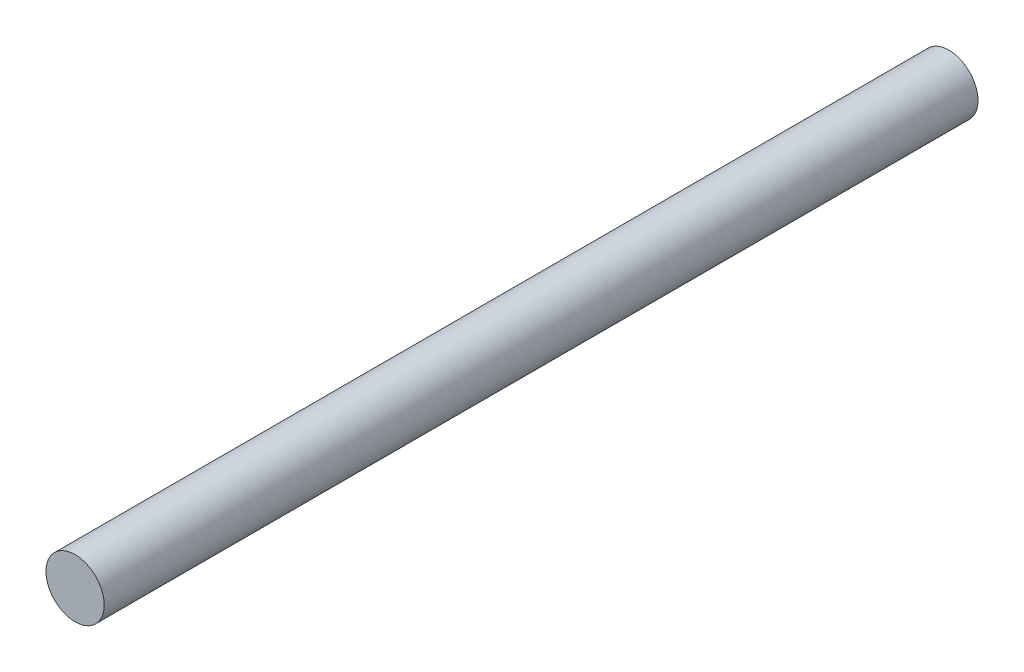
from build123d import *

# Parameters (mm, degrees)
SKETCH1_R           = 5
BOSS_EXTRUDE1_DEPTH = 150


with BuildPart() as part:
    # Sketch1 → Boss-Extrude1 (new body)
    with BuildSketch(Plane.XY):
        Circle(SKETCH1_R)
    extrude(amount=BOSS_EXTRUDE1_DEPTH)


solid = part.part
